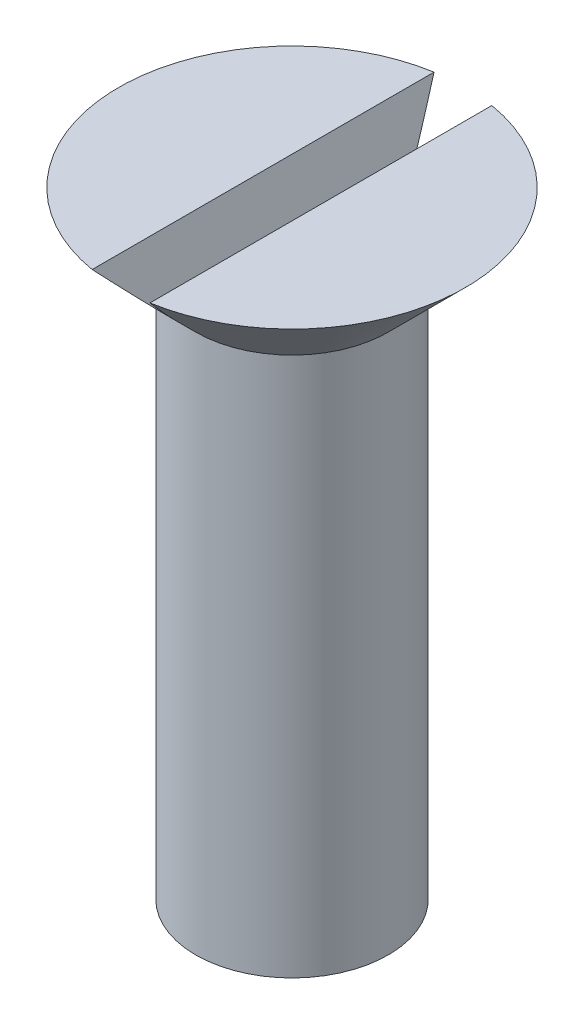
from build123d import *

# Parameters (mm, degrees)
EXTRUDE1_DEPTH = 5


with BuildPart() as part:
    # Sketch1 → Revolve1 (revolve)
    with BuildSketch(Plane.XY, mode=Mode.PRIVATE) as revolve1_sk:
        Polygon((0, 3.780981067), (4.5, 3.780981067), (2.5, 1.780981067), (2.5, -12.219018933), (0, -12.219018933), align=None)
    revolve(revolve1_sk.sketch.rotate(Axis((0, 84.539156627, 0), (0, -1, 0)), 90), axis=Axis((0, 84.539156627, 0), (0, -1, 0)))

    # Sketch2 → Extrude1 (cut, symmetric)
    with BuildSketch(Plane.XY):
        Polygon((-0.75, 3.780981067), (0, 2.280981067), (0.75, 3.780981067), align=None)
    extrude(amount=EXTRUDE1_DEPTH, both=True, mode=Mode.SUBTRACT)


solid = part.part
